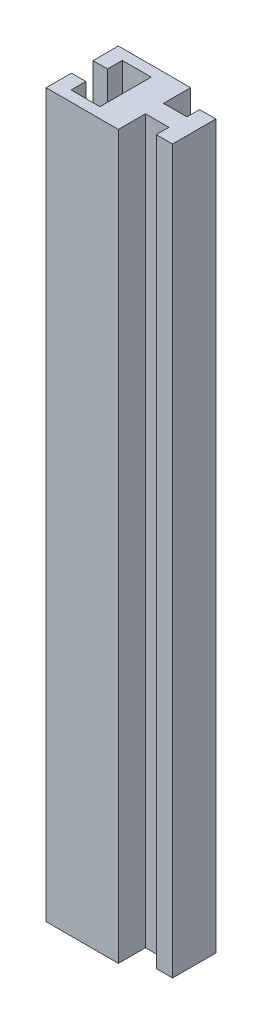
from build123d import *

# Parameters (mm, degrees)
SKETCH1_W           = 10
SKETCH1_H           = 10
BOSS_EXTRUDE2_DEPTH = 100
BOSS_EXTRUDE4_DEPTH = 100
CUT_EXTRUDE1_DEPTH  = 100


with BuildPart() as part:
    # Sketch1 → Boss-Extrude2 (new body)
    with BuildSketch(Plane(origin=(0, 0, 0), x_dir=(1, 0, 0), z_dir=(0, 1, 0))):
        with Locations((-26.008503964, -12.494851211)):
            Rectangle(SKETCH1_W, SKETCH1_H)
    extrude(amount=BOSS_EXTRUDE2_DEPTH)

    # Sketch2 → Boss-Extrude4 (add)
    with BuildSketch(Plane(origin=(0, 100, 0), x_dir=(1, 0, 0), z_dir=(0, 1, 0))):
        Polygon((-21.008503964, -11.244851211), (-17.758503964, -11.244851211), (-17.758503964, -9.494851211), (-15.508503964, -9.494851211), (-15.508503964, -15.494851211), (-17.758503964, -15.494851211), (-17.758503964, -13.744851211), (-21.008503964, -13.744851211), align=None)
    extrude(amount=-BOSS_EXTRUDE4_DEPTH)

    # Sketch3 → Cut-Extrude1 (cut)
    with BuildSketch(Plane(origin=(0, 100, 0), x_dir=(1, 0, 0), z_dir=(0, 1, 0))):
        Polygon((-31.008503964, -13.994851211), (-29.008503964, -13.994851211), (-29.008503964, -16.044851211), (-25.008503964, -16.044851211), (-25.008503964, -8.944851211), (-29.008503964, -8.944851211), (-29.008503964, -10.994851211), (-31.008503964, -10.994851211), align=None)
    extrude(amount=-CUT_EXTRUDE1_DEPTH, mode=Mode.SUBTRACT)


solid = part.part
